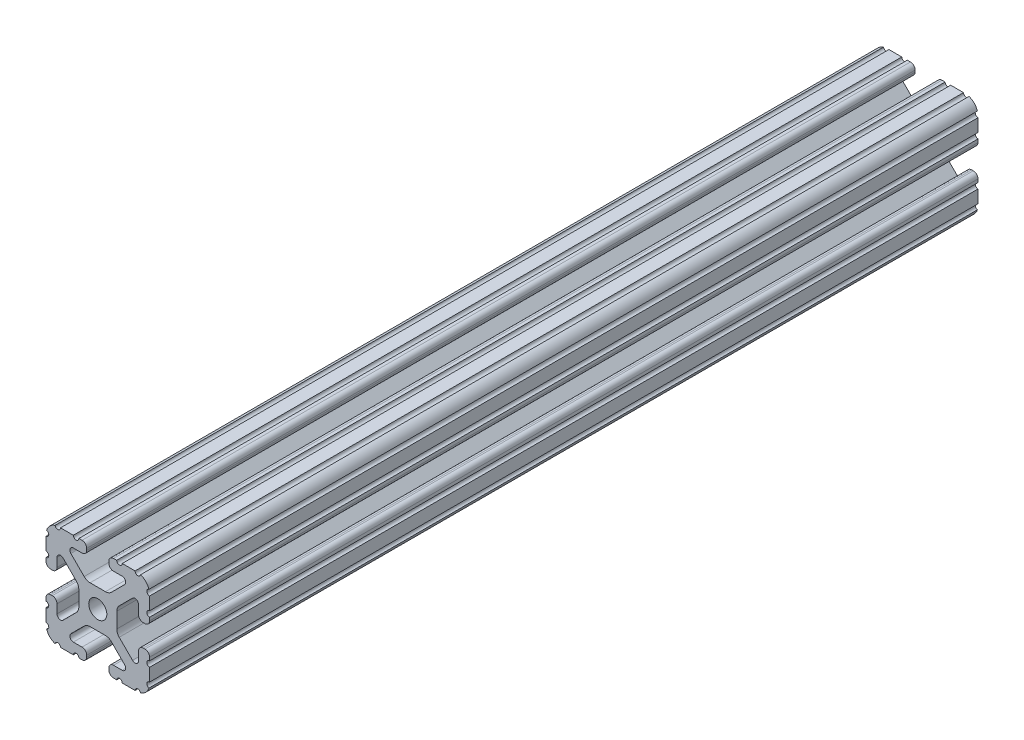
from build123d import *

# Parameters (mm, degrees)
BOSS_EXTRUDE1_DEPTH     = 152.4
CUT_EXTRUDE1_DEPTH      = 155.762931608
CUT_EXTRUDE1_DEPTH_BACK = 155.762931608
SKETCH5_R               = 1.016


with BuildPart() as part:
    # Sketch4 → Boss-Extrude1 (new, symmetric)
    with BuildSketch(Plane.XY):
        with BuildLine():
            Line((5.7912, -19.05), (14.3002, -19.05))
            ThreePointArc((14.3002, -19.05), (17.658815789, -17.658815789), (19.05, -14.3002))
            Line((19.05, -14.3002), (19.05, -5.7912))
            ThreePointArc((19.05, -5.7912), (18.544114832, -4.569885168), (17.3228, -4.064))
            Line((17.3228, -4.064), (16.7132, -4.064))
            ThreePointArc((16.7132, -4.064), (15.491885168, -4.569885168), (14.986, -5.7912))
            Line((14.986, -5.7912), (14.986, -8.996305235))
            ThreePointArc((14.986, -8.996305235), (14.189232738, -10.188751711), (12.782646215, -9.908964256))
            Line((12.782646215, -9.908964256), (7.888897763, -5.015215804))
            ThreePointArc((7.888897763, -5.015215804), (7.219915375, -4.014012907), (6.985, -2.833013566))
            Line((6.985, -2.833013566), (6.985, 0))
            Line((6.985, 0), (3.3274, 0))
            ThreePointArc((3.3274, 0), (2.352827104, -2.352827104), (0, -3.3274))
            Line((0, -3.3274), (0, -6.985))
            Line((0, -6.985), (2.833013566, -6.985))
            ThreePointArc((2.833013566, -6.985), (4.014012907, -7.219915375), (5.015215804, -7.888897763))
            Line((5.015215804, -7.888897763), (9.908964256, -12.782646215))
            ThreePointArc((9.908964256, -12.782646215), (10.188751711, -14.189232738), (8.996305235, -14.986))
            Line((8.996305235, -14.986), (5.7912, -14.986))
            ThreePointArc((5.7912, -14.986), (4.569885168, -15.491885168), (4.064, -16.7132))
            Line((4.064, -16.7132), (4.064, -17.3228))
            ThreePointArc((4.064, -17.3228), (4.569885168, -18.544114832), (5.7912, -19.05))
        make_face()
    extrude(amount=BOSS_EXTRUDE1_DEPTH, both=True)

    # Sketch5 → Cut-Extrude1 (cut, two sides: drawn at the far end of the back side and taken through both)
    with BuildSketch(Plane.XY.offset(-CUT_EXTRUDE1_DEPTH_BACK)):
        with Locations((14.739477062, -19.05)):
            Circle(SKETCH5_R)
        with Locations((7.980305235, -19.05)):
            Circle(SKETCH5_R)
        with Locations((19.05, -14.739477062)):
            Circle(SKETCH5_R)
        with Locations((19.05, -7.980305235)):
            Circle(SKETCH5_R)
    extrude(amount=CUT_EXTRUDE1_DEPTH + CUT_EXTRUDE1_DEPTH_BACK, mode=Mode.SUBTRACT)

    # Mirror1: part across plane


with BuildPart() as part_1:
    add(part.part)
    add(part.part.mirror(Plane(origin=(0, 0, 0), x_dir=(0, 0, 1), z_dir=(1, 0, 0))))

    # Mirror2: part across plane


with BuildPart() as part_2:
    add(part_1.part)
    add(part_1.part.mirror(Plane.ZX))


solid = part_2.part
